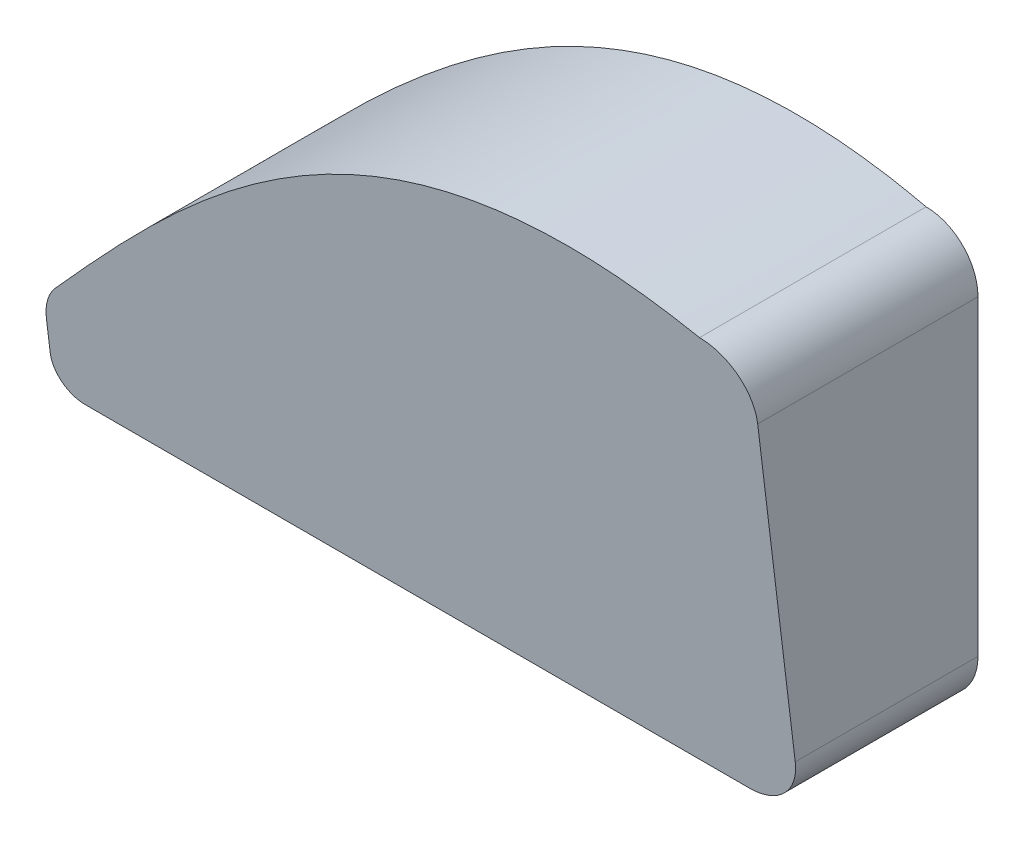
from build123d import *

# Parameters (mm, degrees)
BOSS_EXTRUDE1_DEPTH     = 22
CUT_EXTRUDE3_DEPTH      = 64.348491393
CUT_EXTRUDE3_DEPTH_BACK = 64.348491393


with BuildPart() as part:
    # Sketch1 → Boss-Extrude1 (new body)
    with BuildSketch(Plane.XY):
        with BuildLine():
            Line((54.303030303, 17.598954753), (54.303030303, -12.396681203))
            ThreePointArc((54.303030303, -12.396681203), (52.838564209, -15.932215109), (49.303030303, -17.396681203))
            Line((49.303030303, -17.396681203), (-14.695644242, -17.396681203))
            ThreePointArc((-14.695644242, -17.396681203), (-16.816964585, -16.518001547), (-17.695644242, -14.396681203))
            Line((-17.695644242, -14.396681203), (-17.695644242, -11.306720639))
            ThreePointArc((-17.695644242, -11.306720639), (-17.35823549, -9.50110638), (-16.3915471, -7.939184142))
            add(Edge.make_bspline(
                [(-16.3915471, -7.939184142), (-0.135926549, 9.901511722), (18.69690639, 29.725737375), (49.303030303, 22.598954753)],
                knots=[0.026299547, 0.026299547, 0.026299547, 0.026299547, 1, 1, 1, 1], degree=3))
            ThreePointArc((49.303030303, 22.598954753), (52.838564209, 21.134488659), (54.303030303, 17.598954753))
        make_face()
    extrude(amount=BOSS_EXTRUDE1_DEPTH)

    # Sketch3 → Cut-Extrude3 (cut, two sides: drawn at the far end of the back side and taken through both)
    with BuildSketch(Plane(origin=(0, 0, 0), x_dir=(0, 0, -1), z_dir=(1, 0, 0)).offset(-CUT_EXTRUDE3_DEPTH_BACK)):
        Polygon((-34.434475201, 127.254636362), (-22, 24.087595181), (-17, -17.396681203), (-4.565524799, -120.563722385), (-210.899607163, -145.432672786), (-240.768557564, 102.385685961), align=None)
    extrude(amount=CUT_EXTRUDE3_DEPTH + CUT_EXTRUDE3_DEPTH_BACK, mode=Mode.SUBTRACT)


solid = part.part
